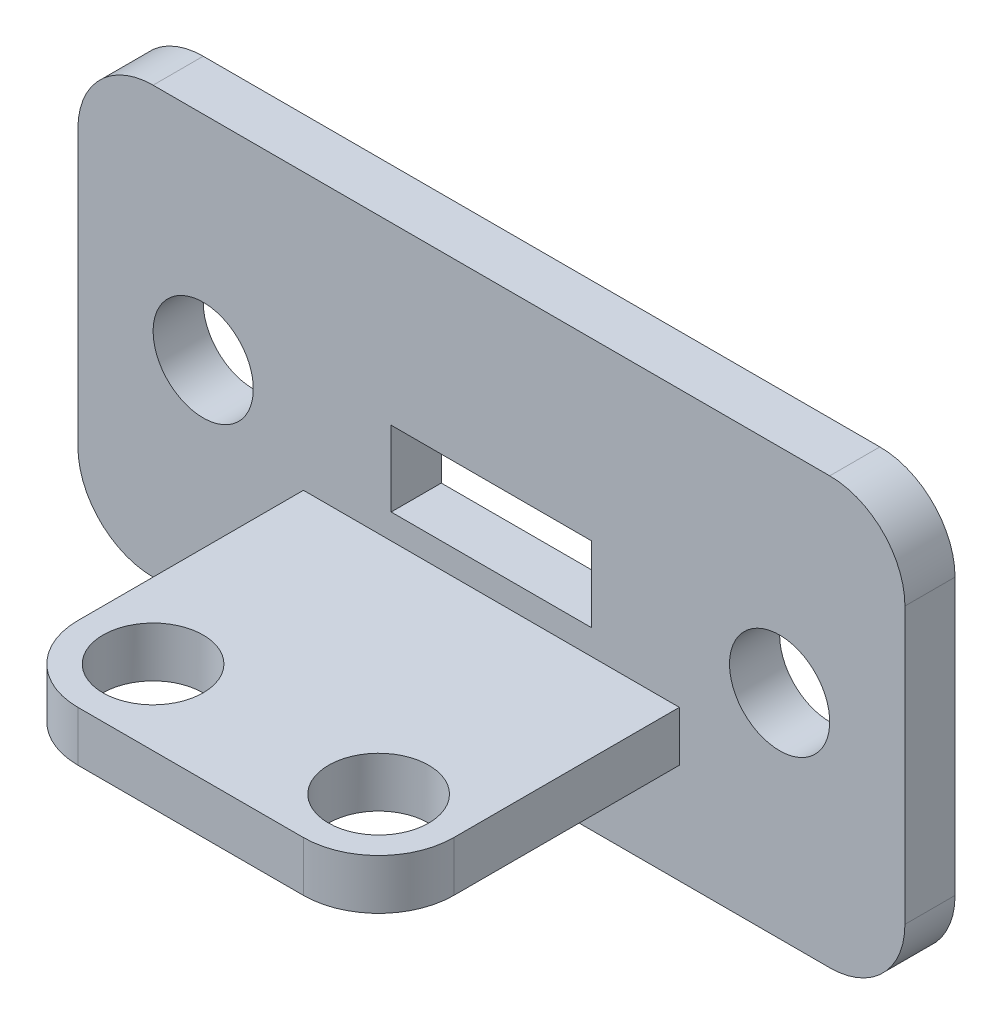
from build123d import *

# Parameters (mm, degrees)
CROQUIS1_W              = 15
CROQUIS1_H              = 12
SALIENTE_EXTRUIR1_DEPTH = 2
CORTAR_EXTRUIR1_REACH   = 11.811
CROQUIS2_R              = 2
CROQUIS3_W              = 33
CROQUIS3_H              = 17
SALIENTE_EXTRUIR2_DEPTH = 2
CORTAR_EXTRUIR3_REACH   = 26.192
CROQUIS5_W              = 8
CROQUIS5_H              = 3
CORTAR_EXTRUIR4_REACH   = 27.244
CROQUIS6_R              = 2
REDONDEO1_R             = 3
REDONDEO2_R             = 3


with BuildPart() as part:
    # Croquis1 → Saliente-Extruir1 (new body)
    with BuildSketch(Plane(origin=(0, 0, 0), x_dir=(1, 0, 0), z_dir=(0, 1, 0))):
        Rectangle(CROQUIS1_W, CROQUIS1_H)
    extrude(amount=SALIENTE_EXTRUIR1_DEPTH)

    # Croquis2 → Cortar-Extruir1 (cut, up to next)
    with BuildSketch(Plane(origin=(0, 2, 0), x_dir=(1, 0, 0), z_dir=(0, 1, 0)), mode=Mode.PRIVATE) as cortar_extruir1_sk1:
        with Locations(Location((-4.5, -3, 0), (0, 0, 270))):
            Circle(CROQUIS2_R)
    cortar_extruir1_tool1 = extrude(cortar_extruir1_sk1.sketch, amount=-CORTAR_EXTRUIR1_REACH, mode=Mode.PRIVATE) & part.part
    # Croquis2 → Cortar-Extruir1 (cut, up to next)
    with BuildSketch(Plane(origin=(0, 2, 0), x_dir=(1, 0, 0), z_dir=(0, 1, 0)), mode=Mode.PRIVATE) as cortar_extruir1_sk2:
        with Locations(Location((4.5, -3, 0), (0, 0, 270))):
            Circle(CROQUIS2_R)
    cortar_extruir1_tool2 = extrude(cortar_extruir1_sk2.sketch, amount=-CORTAR_EXTRUIR1_REACH, mode=Mode.PRIVATE) & part.part
    add(cortar_extruir1_tool1.solids().sort_by_distance((-4.5, 2, 3))[0], mode=Mode.SUBTRACT)
    add(cortar_extruir1_tool2.solids().sort_by_distance((4.5, 2, 3))[0], mode=Mode.SUBTRACT)

    # Croquis3 → Saliente-Extruir2 (add)
    with BuildSketch(Plane(origin=(0, 0, -6), x_dir=(-1, 0, 0), z_dir=(0, 0, -1))):
        with Locations((0, 4.5)):
            Rectangle(CROQUIS3_W, CROQUIS3_H)
    extrude(amount=SALIENTE_EXTRUIR2_DEPTH)

    # Croquis5 → Cortar-Extruir3 (cut, up to next)
    with BuildSketch(Plane.XY.offset(-6), mode=Mode.PRIVATE) as cortar_extruir3_sk1:
        with Locations((0, 4.5)):
            Rectangle(CROQUIS5_W, CROQUIS5_H)
    cortar_extruir3_tool1 = extrude(cortar_extruir3_sk1.sketch, amount=-CORTAR_EXTRUIR3_REACH, mode=Mode.PRIVATE) & part.part
    add(cortar_extruir3_tool1.solids().sort_by_distance((0, 4.5, -6))[0], mode=Mode.SUBTRACT)

    # Croquis6 → Cortar-Extruir4 (cut, up to next)
    with BuildSketch(Plane(origin=(0, 0, -8), x_dir=(-1, 0, 0), z_dir=(0, 0, -1)), mode=Mode.PRIVATE) as cortar_extruir4_sk1:
        with Locations((-11.5, 4.5)):
            Circle(CROQUIS6_R)
    cortar_extruir4_tool1 = extrude(cortar_extruir4_sk1.sketch, amount=-CORTAR_EXTRUIR4_REACH, mode=Mode.PRIVATE) & part.part
    # Croquis6 → Cortar-Extruir4 (cut, up to next)
    with BuildSketch(Plane(origin=(0, 0, -8), x_dir=(-1, 0, 0), z_dir=(0, 0, -1)), mode=Mode.PRIVATE) as cortar_extruir4_sk2:
        with Locations((11.5, 4.5)):
            Circle(CROQUIS6_R)
    cortar_extruir4_tool2 = extrude(cortar_extruir4_sk2.sketch, amount=-CORTAR_EXTRUIR4_REACH, mode=Mode.PRIVATE) & part.part
    add(cortar_extruir4_tool1.solids().sort_by_distance((11.5, 4.5, -8))[0], mode=Mode.SUBTRACT)
    add(cortar_extruir4_tool2.solids().sort_by_distance((-11.5, 4.5, -8))[0], mode=Mode.SUBTRACT)

    # Redondeo1
    redondeo1_edges = [part.edges().sort_by_distance(p)[0] for p in [
        (16.5, 13, -7),
        (16.5, -4, -7),
        (-16.5, -4, -7),
        (-16.5, 13, -7),
    ]]
    fillet(redondeo1_edges, radius=REDONDEO1_R)

    # Redondeo2
    redondeo2_edges = [part.edges().sort_by_distance(p)[0] for p in [
        (7.5, 1, 6),
        (-7.5, 1, 6),
    ]]
    fillet(redondeo2_edges, radius=REDONDEO2_R)


solid = part.part
